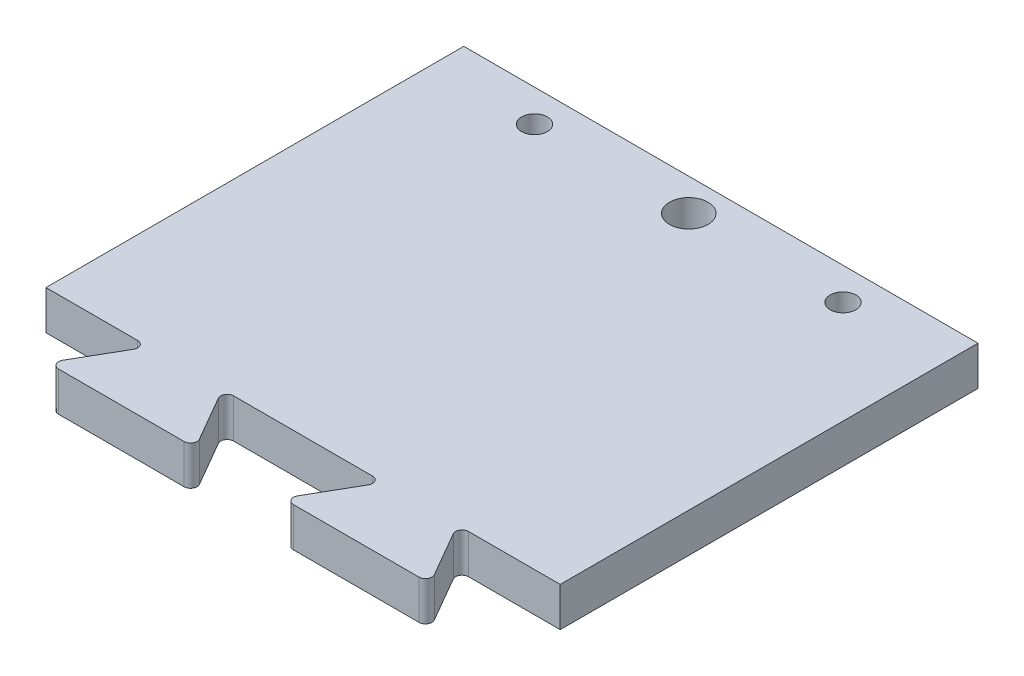
from build123d import *

# Parameters (mm, degrees)
BOSS_EXTRUDE1_DEPTH = 3.05
SKETCH2_R           = 1
SKETCH2_R_2         = 1.5
CUT_EXTRUDE1_DEPTH  = 10
FILLET1_R           = 0.5


with BuildPart() as part:
    # Sketch1 → Boss-Extrude1 (new body)
    with BuildSketch(Plane(origin=(0, 0, 0), x_dir=(1, 0, 0), z_dir=(0, 1, 0))):
        Polygon((0, 0), (0, 32.5), (40, 32.5), (40, 0), (32, 0), (34.886751346, -5), (23.386751346, -5), (26.273502692, 0), (13.726497308, 0), (16.613248654, -5), (5.113248654, -5), (8, 0), align=None)
    extrude(amount=BOSS_EXTRUDE1_DEPTH)

    # Sketch2 → Cut-Extrude1 (cut)
    with BuildSketch(Plane(origin=(0, 3.05, 0), x_dir=(1, 0, 0), z_dir=(0, 1, 0))):
        with Locations(Location((8, 30, 0), (0, 0, 270))):
            Circle(SKETCH2_R)
        with Locations(Location((32, 30, 0), (0, 0, 270))):
            Circle(SKETCH2_R)
        with Locations(Location((20, 30, 0), (0, 0, 270))):
            Circle(SKETCH2_R_2)
    extrude(amount=-CUT_EXTRUDE1_DEPTH, mode=Mode.SUBTRACT)

    # Fillet1
    fillet1_edges = [part.edges().sort_by_distance(p)[0] for p in [
        (32, 1.525, 0),
        (34.886751346, 1.525, 5),
        (23.386751346, 1.525, 5),
        (26.273502692, 1.525, 0),
        (13.726497308, 1.525, 0),
        (16.613248654, 1.525, 5),
        (5.113248654, 1.525, 5),
        (8, 1.525, 0),
    ]]
    fillet(fillet1_edges, radius=FILLET1_R)


solid = part.part
